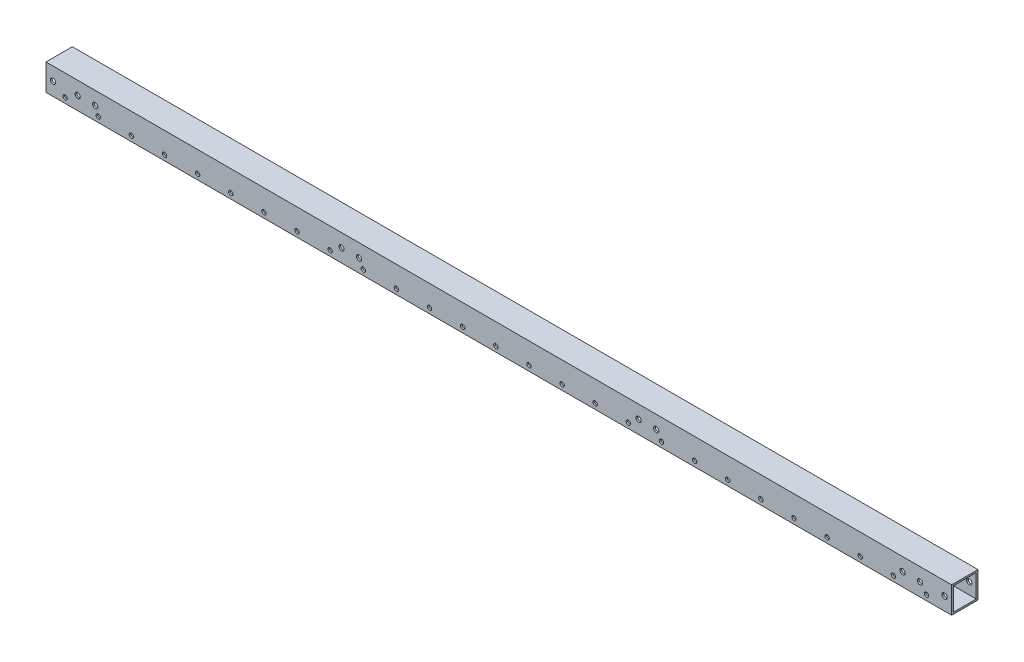
from build123d import *

# Parameters (mm, degrees)
EXTRUDE_1_DEPTH      = 257.5
EXTRUDE_1_DEPTH_BACK = 257.5
SKETCH_1_W           = 15
SKETCH_1_H           = 15
SKETCH_1_W_2         = 13
SKETCH_1_H_2         = 13
SKETCH_2_R           = 1.25
SKETCH_2_R_2         = 1.5
CUT_EXTRUDE_1_DEPTH  = 259.045538617


with BuildPart() as part:
    # 草图1 → 凸台-拉伸1 (new, two sides: drawn at the far end of the back side and taken through both)
    with BuildSketch(Plane(origin=(0, 0, 0), x_dir=(0, 0, -1), z_dir=(1, 0, 0)).offset(-EXTRUDE_1_DEPTH_BACK)):
        Rectangle(SKETCH_1_W, SKETCH_1_H)
        Rectangle(SKETCH_1_W_2, SKETCH_1_H_2, mode=Mode.SUBTRACT)
    extrude(amount=EXTRUDE_1_DEPTH + EXTRUDE_1_DEPTH_BACK)

    # 草图2 → 切除-拉伸1 (cut, through all)
    with BuildSketch(Plane(origin=(0, 0, -7.5), x_dir=(-1, 0, 0), z_dir=(0, 0, -1))):
        with Locations((-243.21681474, -4.5)):
            Circle(SKETCH_2_R)
        with Locations((-253.5, 0)):
            Circle(SKETCH_2_R_2)
        with Locations((253.5, 0)):
            Circle(SKETCH_2_R_2)
        with Locations((-239.5, 0)):
            Circle(SKETCH_2_R_2)
        with Locations((-229.5, 0)):
            Circle(SKETCH_2_R_2)
        with Locations((229.5, 0)):
            Circle(SKETCH_2_R_2)
        with Locations((239.5, 0)):
            Circle(SKETCH_2_R_2)
        with Locations((-89.5, 0)):
            Circle(SKETCH_2_R_2)
        with Locations((-79.5, 0)):
            Circle(SKETCH_2_R_2)
        with Locations((79.5, 0)):
            Circle(SKETCH_2_R_2)
        with Locations((89.5, 0)):
            Circle(SKETCH_2_R_2)
        with Locations((-224.37681474, -4.5)):
            Circle(SKETCH_2_R)
        with Locations((-205.53681474, -4.5)):
            Circle(SKETCH_2_R)
        with Locations((-186.69681474, -4.5)):
            Circle(SKETCH_2_R)
        with Locations((-167.85681474, -4.5)):
            Circle(SKETCH_2_R)
        with Locations((-149.01681474, -4.5)):
            Circle(SKETCH_2_R)
        with Locations((-130.17681474, -4.5)):
            Circle(SKETCH_2_R)
        with Locations((-111.33681474, -4.5)):
            Circle(SKETCH_2_R)
        with Locations((-92.49681474, -4.5)):
            Circle(SKETCH_2_R)
        with Locations((-73.65681474, -4.5)):
            Circle(SKETCH_2_R)
        with Locations((-54.81681474, -4.5)):
            Circle(SKETCH_2_R)
        with Locations((-35.97681474, -4.5)):
            Circle(SKETCH_2_R)
        with Locations((-17.13681474, -4.5)):
            Circle(SKETCH_2_R)
        with Locations((1.70318526, -4.5)):
            Circle(SKETCH_2_R)
        with Locations((20.54318526, -4.5)):
            Circle(SKETCH_2_R)
        with Locations((39.38318526, -4.5)):
            Circle(SKETCH_2_R)
        with Locations((58.22318526, -4.5)):
            Circle(SKETCH_2_R)
        with Locations((77.06318526, -4.5)):
            Circle(SKETCH_2_R)
        with Locations((95.90318526, -4.5)):
            Circle(SKETCH_2_R)
        with Locations((114.74318526, -4.5)):
            Circle(SKETCH_2_R)
        with Locations((133.58318526, -4.5)):
            Circle(SKETCH_2_R)
        with Locations((152.42318526, -4.5)):
            Circle(SKETCH_2_R)
        with Locations((171.26318526, -4.5)):
            Circle(SKETCH_2_R)
        with Locations((190.10318526, -4.5)):
            Circle(SKETCH_2_R)
        with Locations((208.94318526, -4.5)):
            Circle(SKETCH_2_R)
        with Locations((227.78318526, -4.5)):
            Circle(SKETCH_2_R)
        with Locations((246.62318526, -4.5)):
            Circle(SKETCH_2_R)
        with Locations((265.46318526, -4.5)):
            Circle(SKETCH_2_R)
        with Locations((284.30318526, -4.5)):
            Circle(SKETCH_2_R)
        with Locations((303.14318526, -4.5)):
            Circle(SKETCH_2_R)
    extrude(amount=-CUT_EXTRUDE_1_DEPTH, mode=Mode.SUBTRACT)


solid = part.part
